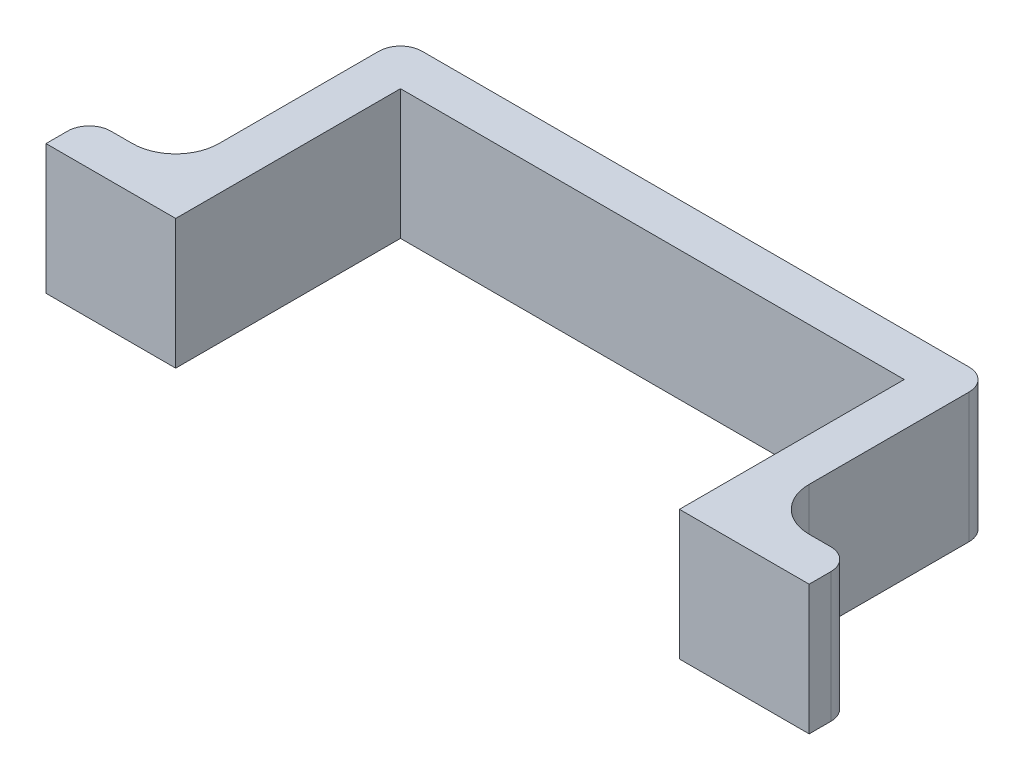
from build123d import *

# Parameters (mm, degrees)
BOSS_EXTRUDE1_DEPTH = 19.05


with BuildPart() as part:
    # Sketch1 → Boss-Extrude1 (new body)
    with BuildSketch(Plane(origin=(0, 0, 0), x_dir=(1, 0, 0), z_dir=(0, 1, 0))):
        with BuildLine():
            Line((-37, -33.02), (-37, 0))
            Line((-37, 0), (37, 0))
            Line((37, 0), (37, -33.02))
            Line((37, -33.02), (56.05, -33.02))
            Line((56.05, -33.02), (56.05, -29.845))
            ThreePointArc((56.05, -29.845), (55.12006403, -27.59993597), (52.875, -26.67))
            Line((52.875, -26.67), (49.7, -26.67))
            ThreePointArc((49.7, -26.67), (45.209871939, -24.810128061), (43.35, -20.32))
            Line((43.35, -20.32), (43.35, 0))
            Line((43.35, 0), (43.35, 3.175))
            ThreePointArc((43.35, 3.175), (42.42006403, 5.42006403), (40.175, 6.35))
            Line((40.175, 6.35), (-40.175, 6.35))
            ThreePointArc((-40.175, 6.35), (-42.42006403, 5.42006403), (-43.35, 3.175))
            Line((-43.35, 3.175), (-43.35, 0))
            Line((-43.35, 0), (-43.35, -20.32))
            ThreePointArc((-43.35, -20.32), (-45.209871939, -24.810128061), (-49.7, -26.67))
            Line((-49.7, -26.67), (-52.875, -26.67))
            ThreePointArc((-52.875, -26.67), (-55.12006403, -27.59993597), (-56.05, -29.845))
            Line((-56.05, -29.845), (-56.05, -33.02))
            Line((-56.05, -33.02), (-37, -33.02))
        make_face()
    extrude(amount=BOSS_EXTRUDE1_DEPTH)


solid = part.part
